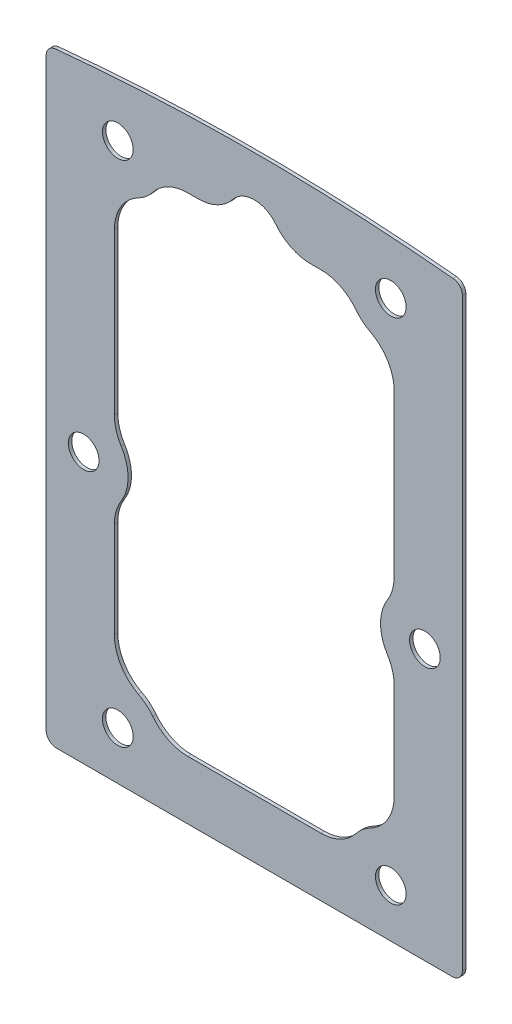
from build123d import *

# Parameters (mm, degrees)
SKETCH1_R           = 4.5
BOSS_EXTRUDE1_DEPTH = 1


with BuildPart() as part:
    # Sketch1 → Boss-Extrude1 (new body)
    with BuildSketch(Plane.XY):
        with BuildLine():
            Line((-61, 85.675899882), (-61, -85.675899882))
            ThreePointArc((-61, -85.675899882), (-60.121320344, -87.797220225), (-58, -88.675899882))
            Line((-58, -88.675899882), (58, -88.675899882))
            ThreePointArc((58, -88.675899882), (60.121320344, -87.797220225), (61, -85.675899882))
            Line((61, -85.675899882), (61, 85.675899882))
            ThreePointArc((61, 85.675899882), (60.221977932, 87.691542228), (58.291457286, 88.661708424))
            ThreePointArc((58.291457286, 88.661708424), (0, 91.5), (-58.291457286, 88.661708424))
            ThreePointArc((-58.291457286, 88.661708424), (-60.221977932, 87.691542228), (-61, 85.675899882))
        make_face()
        with Locations((-40, 74.5)):
            Circle(SKETCH1_R, mode=Mode.SUBTRACT)
        with Locations((-50, -9.5)):
            Circle(SKETCH1_R, mode=Mode.SUBTRACT)
        with Locations((-40, -74.5)):
            Circle(SKETCH1_R, mode=Mode.SUBTRACT)
        with Locations(Location((40, -74.5, 0), (0, 0, 180))):
            Circle(SKETCH1_R, mode=Mode.SUBTRACT)
        with Locations(Location((50, -9.5, 0), (0, 0, 180))):
            Circle(SKETCH1_R, mode=Mode.SUBTRACT)
        with Locations(Location((40, 74.5, 0), (0, 0, 180))):
            Circle(SKETCH1_R, mode=Mode.SUBTRACT)
        with BuildLine():
            Line((-41, -23.356406461), (-41, -51.434874811))
            ThreePointArc((-41, -51.434874811), (-39.113055385, -58.180243592), (-34, -62.967437405))
            ThreePointArc((-34, -62.967437405), (-31.68672135, -64.505531626), (-29.753049234, -66.5))
            ThreePointArc((-29.753049234, -66.5), (-25.206975594, -70.183321446), (-19.506098468, -71.5))
            Line((-19.506098468, -71.5), (19.506098468, -71.5))
            ThreePointArc((19.506098468, -71.5), (25.206975594, -70.183321446), (29.753049234, -66.5))
            ThreePointArc((29.753049234, -66.5), (31.68672135, -64.505531626), (34, -62.967437405))
            ThreePointArc((34, -62.967437405), (39.113055385, -58.180243592), (41, -51.434874811))
            Line((41, -51.434874811), (41, -23.356406461))
            ThreePointArc((41, -23.356406461), (40.489995997, -19.750855185), (39, -16.42820323))
            ThreePointArc((39, -16.42820323), (37, -9.5), (39, -2.57179677))
            ThreePointArc((39, -2.57179677), (40.489995997, 0.750855185), (41, 4.356406461))
            Line((41, 4.356406461), (41, 51.434874811))
            ThreePointArc((41, 51.434874811), (39.113055385, 58.180243592), (34, 62.967437405))
            ThreePointArc((34, 62.967437405), (31.68672135, 64.505531626), (29.753049234, 66.5))
            ThreePointArc((29.753049234, 66.5), (25.206975594, 70.183321446), (19.506098468, 71.5))
            Line((19.506098468, 71.5), (16.492422502, 71.5))
            ThreePointArc((16.492422502, 71.5), (10.818757356, 72.803439659), (6.28282762, 76.452380952))
            ThreePointArc((6.28282762, 76.452380952), (0, 79.5), (-6.28282762, 76.452380952))
            ThreePointArc((-6.28282762, 76.452380952), (-10.818757356, 72.803439659), (-16.492422502, 71.5))
            Line((-16.492422502, 71.5), (-19.506098468, 71.5))
            ThreePointArc((-19.506098468, 71.5), (-25.206975594, 70.183321446), (-29.753049234, 66.5))
            ThreePointArc((-29.753049234, 66.5), (-31.68672135, 64.505531626), (-34, 62.967437405))
            ThreePointArc((-34, 62.967437405), (-39.113055385, 58.180243592), (-41, 51.434874811))
            Line((-41, 51.434874811), (-41, 4.356406461))
            ThreePointArc((-41, 4.356406461), (-40.489995997, 0.750855185), (-39, -2.57179677))
            ThreePointArc((-39, -2.57179677), (-37, -9.5), (-39, -16.42820323))
            ThreePointArc((-39, -16.42820323), (-40.489995997, -19.750855185), (-41, -23.356406461))
        make_face(mode=Mode.SUBTRACT)
    extrude(amount=BOSS_EXTRUDE1_DEPTH)


solid = part.part
